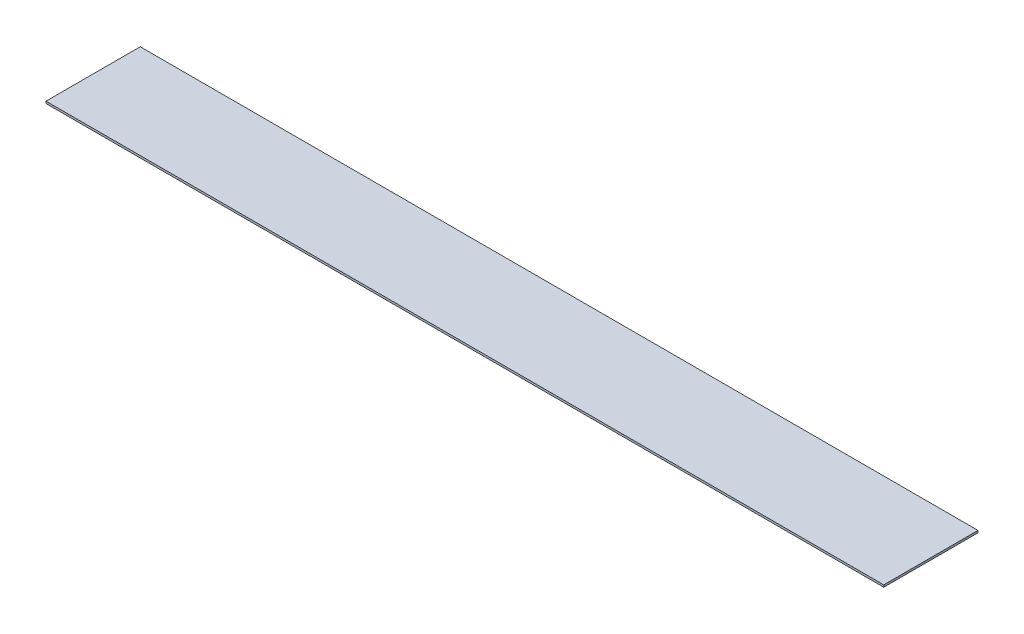
from build123d import *

# Parameters (mm, degrees)
SKETCH1_W           = 4000
SKETCH1_H           = 450
BOSS_EXTRUDE1_DEPTH = 10


with BuildPart() as part:
    # Sketch1 → Boss-Extrude1 (new body)
    with BuildSketch(Plane(origin=(0, 0, 0), x_dir=(1, 0, 0), z_dir=(0, 1, 0))):
        Rectangle(SKETCH1_W, SKETCH1_H)
    extrude(amount=BOSS_EXTRUDE1_DEPTH)


solid = part.part
